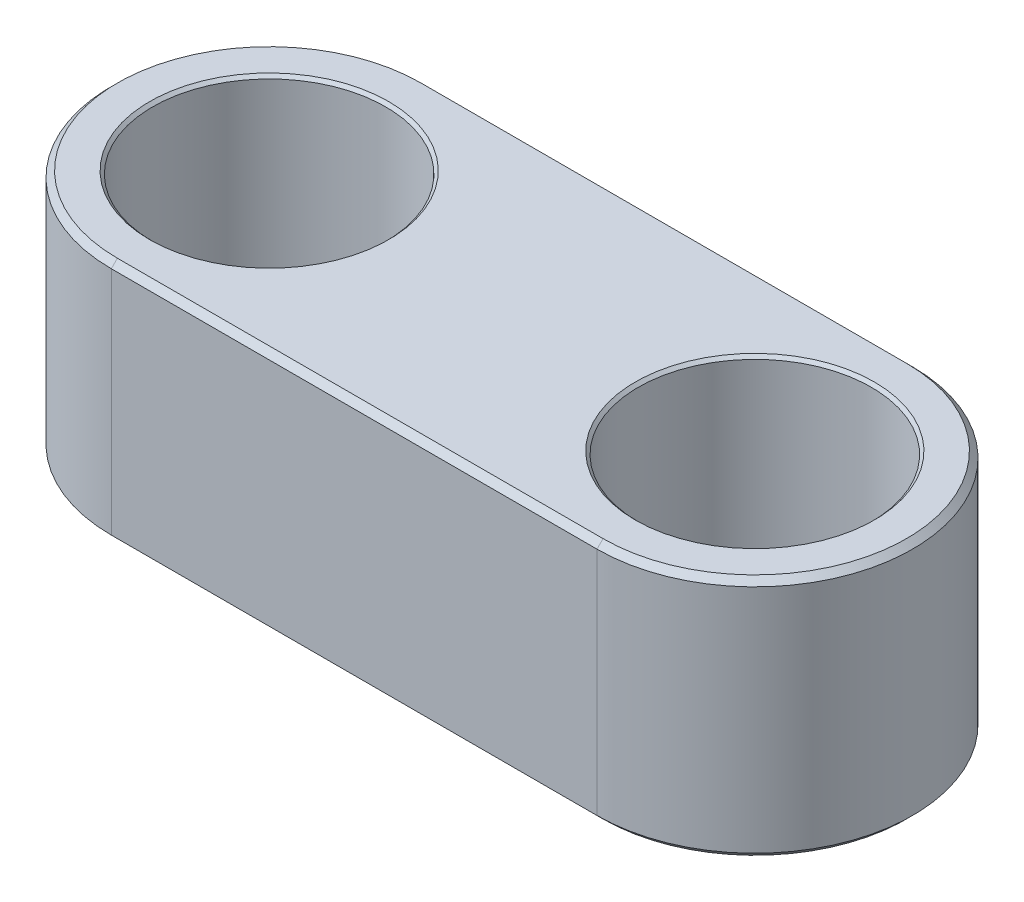
from build123d import *

# Parameters (mm, degrees)
SKETCH1_R           = 19.2
BOSS_EXTRUDE1_DEPTH = 40
SHELL1_T            = -6
CHAMFER1_SIZE       = 1
RIB1_REACH          = 118.241
SKETCH2_WALLS_W     = 6
SKETCH2_WALLS_H     = 263.960304727
FILLET1_R           = 1
BOSS_EXTRUDE2_START = -3
BOSS_EXTRUDE2_DEPTH = 3
CHAMFER2_SIZE       = 0.5


with BuildPart() as part:
    # Sketch1 → Boss-Extrude1 (new body)
    with BuildSketch(Plane(origin=(0, 0, 0), x_dir=(1, 0, 0), z_dir=(0, 1, 0))):
        with BuildLine():
            Line((0, 26), (80, 26))
            ThreePointArc((80, 26), (106, 0), (80, -26))
            Line((80, -26), (0, -26))
            ThreePointArc((0, -26), (-26, 0), (0, 26))
        make_face()
        with Locations(Location((0, 0, 0), (0, 0, 270))):
            Circle(SKETCH1_R, mode=Mode.SUBTRACT)
        with Locations(Location((80, 0, 0), (0, 0, 270))):
            Circle(SKETCH1_R, mode=Mode.SUBTRACT)
    extrude(amount=BOSS_EXTRUDE1_DEPTH)

    # Shell1
    shell1_openings = [part.faces().sort_by_distance(p)[0] for p in [
        (40, 40, 0),
    ]]
    offset(amount=SHELL1_T, openings=shell1_openings, kind=Kind.INTERSECTION)

    # Chamfer1
    chamfer1_edges = [part.edges().sort_by_distance(p)[0] for p in [
        (106, 40, 0),
        (40, 40, -26),
        (-26, 40, 0),
        (40, 0, -26),
        (106, 0, 0),
        (40, 0, 26),
        (-26, 0, 0),
        (40, 40, 26),
    ]]
    chamfer(chamfer1_edges, length=CHAMFER1_SIZE)

    # Sketch2 walls → Rib1 (add, up to next)
    with BuildSketch(Plane(origin=(0, 40, 0), x_dir=(1, 0, 0), z_dir=(0, 1, 0)), mode=Mode.PRIVATE) as rib1_sk1:
        with Locations((40, 0.813044615)):
            Rectangle(SKETCH2_WALLS_W, SKETCH2_WALLS_H)
    rib1_tool1 = extrude(rib1_sk1.sketch, amount=-RIB1_REACH, mode=Mode.PRIVATE) - part.part
    add(rib1_tool1.solids().sort_by_distance((40, 40, -0.813044614))[0])

    # Fillet1
    fillet1_edges = [part.edges().sort_by_distance(p)[0] for p in [
        (64.668985683, 23, 20),
        (15.331014317, 23, -20),
        (15.331014317, 23, 20),
        (64.668985683, 23, -20),
        (37, 23, 20),
        (37, 23, -20),
    ]]
    fillet(fillet1_edges, radius=FILLET1_R)

    # Sketch3 → Boss-Extrude2 (add)
    with BuildSketch(Plane(origin=(0, 40, 0), x_dir=(1, 0, 0), z_dir=(0, 1, 0)).offset(BOSS_EXTRUDE2_START)):
        with BuildLine():
            Line((18.039955654, 20), (61.960044346, 20))
            ThreePointArc((61.960044346, 20), (62.888804498, 19.370681238), (62.648592272, 18.27480916))
            ThreePointArc((62.648592272, 18.27480916), (54.8, 0), (62.648592272, -18.27480916))
            ThreePointArc((62.648592272, -18.27480916), (62.888804498, -19.370681238), (61.960044346, -20))
            Line((61.960044346, -20), (18.039955654, -20))
            ThreePointArc((18.039955654, -20), (17.111195502, -19.370681238), (17.351407728, -18.27480916))
            ThreePointArc((17.351407728, -18.27480916), (25.2, 0), (17.351407728, 18.27480916))
            ThreePointArc((17.351407728, 18.27480916), (17.111195502, 19.370681238), (18.039955654, 20))
        make_face()
    extrude(amount=BOSS_EXTRUDE2_DEPTH)

    # Chamfer2
    chamfer2_edges = [part.edges().sort_by_distance(p)[0] for p in [
        (0, 0, -19.2),
        (0, 40, -19.2),
        (80, 0, -19.2),
        (80, 40, -19.2),
    ]]
    chamfer(chamfer2_edges, length=CHAMFER2_SIZE)


solid = part.part
